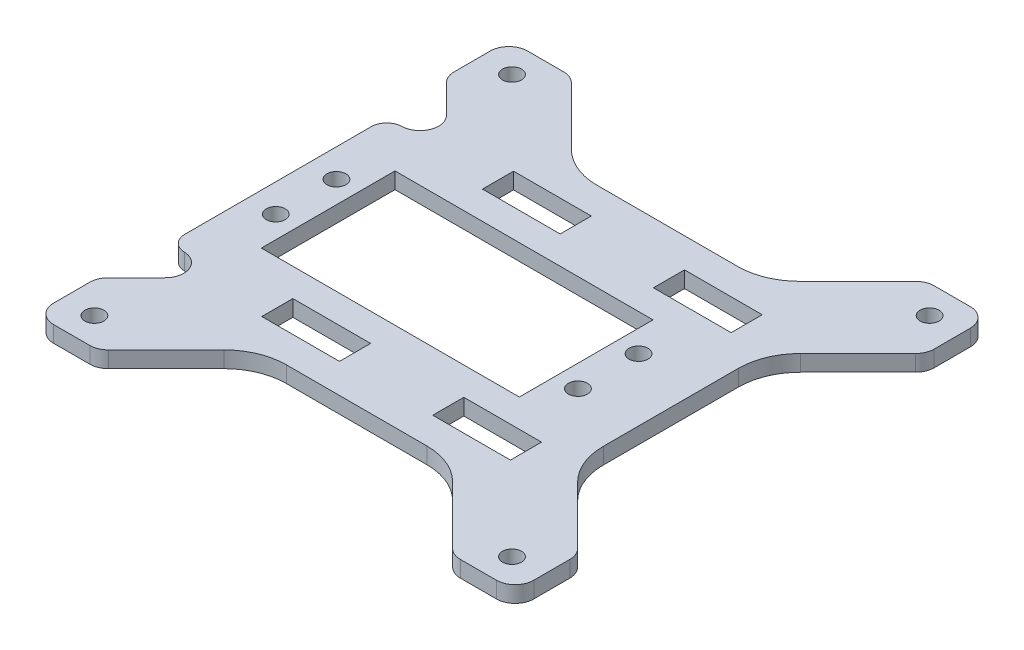
from build123d import *

# Parameters (mm, degrees)
SKETCH_1_R      = 1.75
SKETCH_1_W      = 14.344262296
SKETCH_1_H      = 5.737704918
SKETCH_1_W_2    = 14.344262295
SKETCH_1_W_3    = 47.62295082
SKETCH_1_H_2    = 24.672131148
EXTRUDE_1_DEPTH = 3


with BuildPart() as part:
    # 草图1 → 凸台-拉伸1 (new body)
    with BuildSketch(Plane.XZ):
        with BuildLine():
            Line((-27.944138099, -25.958892198), (-33.179876582, -31.19463068))
            ThreePointArc((-33.179876582, -31.19463068), (-33.926143431, -32.311497947), (-34.188197499, -33.628932714))
            Line((-34.188197499, -33.628932714), (-34.188197499, -40.293115532))
            ThreePointArc((-34.188197499, -40.293115532), (-33.179876582, -42.727417565), (-30.745574548, -43.735738483))
            Line((-30.745574548, -43.735738483), (-24.08139173, -43.735738483))
            ThreePointArc((-24.08139173, -43.735738483), (-22.763956963, -43.473684414), (-21.647089697, -42.727417565))
            Line((-21.647089697, -42.727417565), (-10.969266445, -32.049594314))
            ThreePointArc((-10.969266445, -32.049594314), (-7.246375557, -29.562038152), (-2.854926333, -28.68852459))
            Line((-2.854926333, -28.68852459), (23.097549284, -28.68852459))
            ThreePointArc((23.097549284, -28.68852459), (27.488998508, -29.562038152), (31.211889396, -32.049594314))
            Line((31.211889396, -32.049594314), (41.889712647, -42.727417565))
            ThreePointArc((41.889712647, -42.727417565), (43.006579914, -43.473684414), (44.324014681, -43.735738483))
            Line((44.324014681, -43.735738483), (50.988197499, -43.735738483))
            ThreePointArc((50.988197499, -43.735738483), (53.422499533, -42.727417565), (54.43082045, -40.293115532))
            Line((54.43082045, -40.293115532), (54.43082045, -33.628932714))
            ThreePointArc((54.43082045, -33.628932714), (54.168766382, -32.311497947), (53.422499533, -31.19463068))
            Line((53.422499533, -31.19463068), (42.802053331, -20.574184478))
            ThreePointArc((42.802053331, -20.574184478), (40.314497168, -16.85129359), (39.440983607, -12.459844366))
            Line((39.440983607, -12.459844366), (39.440983607, 12.459844366))
            ThreePointArc((39.440983607, 12.459844366), (40.314497168, 16.85129359), (42.802053331, 20.574184478))
            Line((42.802053331, 20.574184478), (53.422499533, 31.19463068))
            ThreePointArc((53.422499533, 31.19463068), (54.168766382, 32.311497947), (54.43082045, 33.628932714))
            Line((54.43082045, 33.628932714), (54.43082045, 40.293115532))
            ThreePointArc((54.43082045, 40.293115532), (53.422499533, 42.727417565), (50.988197499, 43.735738483))
            Line((50.988197499, 43.735738483), (44.324014681, 43.735738483))
            ThreePointArc((44.324014681, 43.735738483), (43.006579914, 43.473684414), (41.889712647, 42.727417565))
            Line((41.889712647, 42.727417565), (31.211889396, 32.049594314))
            ThreePointArc((31.211889396, 32.049594314), (27.488998508, 29.562038152), (23.097549284, 28.68852459))
            Line((23.097549284, 28.68852459), (-2.854926333, 28.68852459))
            ThreePointArc((-2.854926333, 28.68852459), (-7.246375557, 29.562038152), (-10.969266445, 32.049594314))
            Line((-10.969266445, 32.049594314), (-21.647089697, 42.727417565))
            ThreePointArc((-21.647089697, 42.727417565), (-22.763956963, 43.473684414), (-24.08139173, 43.735738483))
            Line((-24.08139173, 43.735738483), (-30.745574548, 43.735738483))
            ThreePointArc((-30.745574548, 43.735738483), (-33.179876582, 42.727417565), (-34.188197499, 40.293115532))
            Line((-34.188197499, 40.293115532), (-34.188197499, 33.628932714))
            ThreePointArc((-34.188197499, 33.628932714), (-33.926143431, 32.311497947), (-33.179876582, 31.19463068))
            Line((-33.179876582, 31.19463068), (-27.944138099, 25.958892198))
            ThreePointArc((-27.944138099, 25.958892198), (-27.180473754, 22.249967152), (-30.286027184, 20.083207792))
            ThreePointArc((-30.286027184, 20.083207792), (-32.264648538, 19.216561535), (-33.077868852, 17.215389149))
            Line((-33.077868852, 17.215389149), (-33.077868852, -17.215389149))
            ThreePointArc((-33.077868852, -17.215389149), (-32.264648538, -19.216561535), (-30.286027184, -20.083207792))
            ThreePointArc((-30.286027184, -20.083207792), (-27.180473754, -22.249967152), (-27.944138099, -25.958892198))
        make_face()
        with Locations(Location((48.664427007, 38.543115532, 0), (0, 0, 90))):
            Circle(SKETCH_1_R, mode=Mode.SUBTRACT)
        with Locations(Location((-28.421804056, -38.543115532, 0), (0, 0, 90))):
            Circle(SKETCH_1_R, mode=Mode.SUBTRACT)
        with Locations(Location((27.885245902, 5.594262295, 0), (0, 0, 90))):
            Circle(SKETCH_1_R, mode=Mode.SUBTRACT)
        with Locations(Location((-27.885245902, 5.594262295, 0), (0, 0, 90))):
            Circle(SKETCH_1_R, mode=Mode.SUBTRACT)
        with Locations(Location((-27.885245902, -5.594262295, 0), (0, 0, 90))):
            Circle(SKETCH_1_R, mode=Mode.SUBTRACT)
        with Locations(Location((27.885245902, -5.594262295, 0), (0, 0, 90))):
            Circle(SKETCH_1_R, mode=Mode.SUBTRACT)
        with Locations(Location((48.664427007, -38.543115532, 0), (0, 0, 90))):
            Circle(SKETCH_1_R, mode=Mode.SUBTRACT)
        with Locations(Location((-28.421804056, 38.543115532, 0), (0, 0, 90))):
            Circle(SKETCH_1_R, mode=Mode.SUBTRACT)
        with Locations((25.9, -20.368852459)):
            Rectangle(SKETCH_1_W, SKETCH_1_H, mode=Mode.SUBTRACT)
        with Locations((-5.65737705, 20.368852459)):
            Rectangle(SKETCH_1_W_2, SKETCH_1_H, mode=Mode.SUBTRACT)
        Rectangle(SKETCH_1_W_3, SKETCH_1_H_2, mode=Mode.SUBTRACT)
        with Locations((25.9, 20.368852459)):
            Rectangle(SKETCH_1_W, SKETCH_1_H, mode=Mode.SUBTRACT)
        with Locations((-5.65737705, -20.368852459)):
            Rectangle(SKETCH_1_W_2, SKETCH_1_H, mode=Mode.SUBTRACT)
    extrude(amount=-EXTRUDE_1_DEPTH)


solid = part.part
